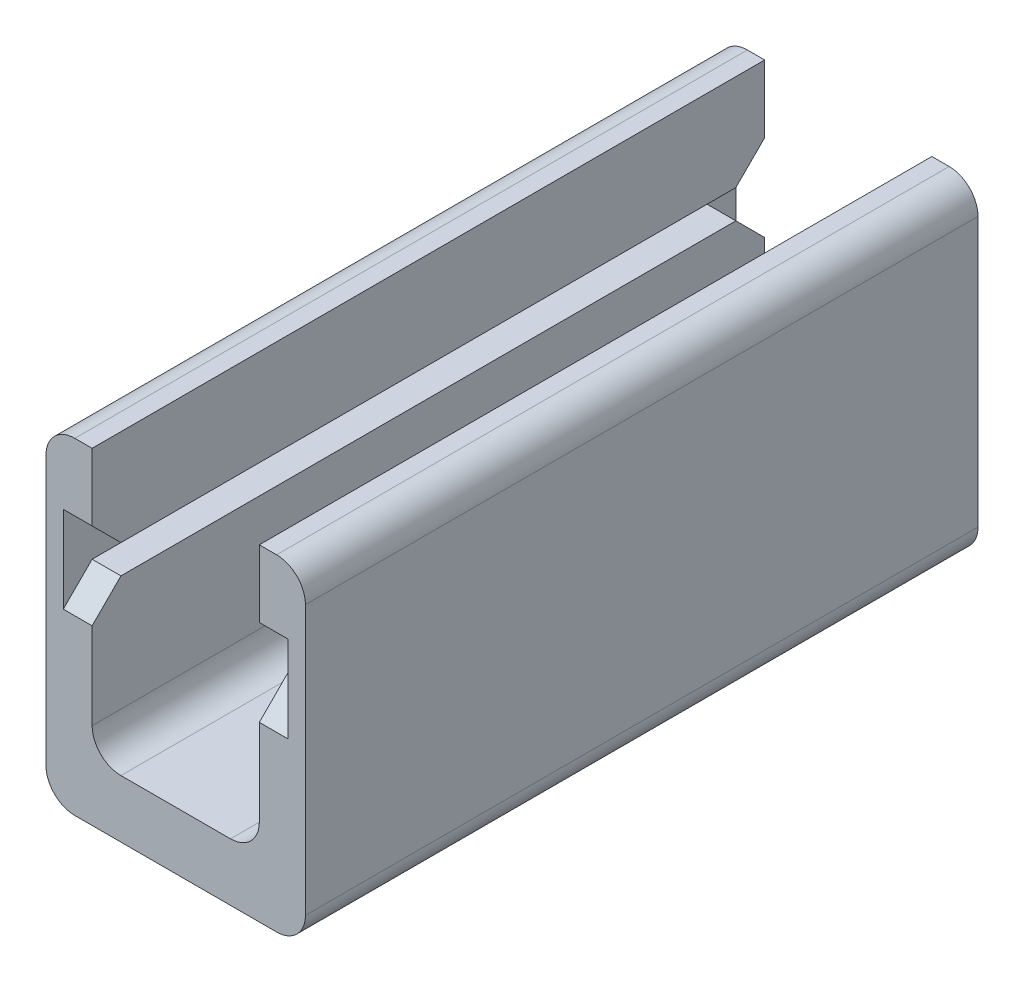
from build123d import *

# Parameters (mm, degrees)
AUFSATZ_LINEAR_AUSTRAGEN1_DEPTH = 35
VERRUNDUNG1_R                   = 1.5
FASE1_SIZE                      = 1.5


with BuildPart() as part:
    # Skizze1 → Aufsatz-Linear austragen1 (new body)
    with BuildSketch(Plane.XY):
        Polygon((-6.75, 0), (6.75, 0), (6.75, 17), (4.35, 17), (4.35, 12), (5.85, 12), (5.85, 10.5), (4.35, 10.5), (4.35, 3), (-4.35, 3), (-4.35, 10.5), (-5.85, 10.5), (-5.85, 12), (-4.35, 12), (-4.35, 17), (-6.75, 17), align=None)
    extrude(amount=AUFSATZ_LINEAR_AUSTRAGEN1_DEPTH)

    # Verrundung1
    verrundung1_edges = [part.edges().sort_by_distance(p)[0] for p in [
        (6.75, 0, 17.5),
        (-6.75, 0, 17.5),
        (-6.75, 17, 17.5),
        (-4.35, 3, 17.5),
        (4.35, 3, 17.5),
        (6.75, 17, 17.5),
    ]]
    fillet(verrundung1_edges, radius=VERRUNDUNG1_R)

    # Fase1
    fase1_edges = [part.edges().sort_by_distance(p)[0] for p in [
        (5.1, 12, 35),
        (-5.1, 12, 0),
        (-5.1, 10.5, 0),
        (5.1, 10.5, 0),
        (5.1, 12, 0),
        (5.1, 10.5, 35),
        (-5.1, 10.5, 35),
        (-5.1, 12, 35),
    ]]
    chamfer(fase1_edges, length=FASE1_SIZE)


solid = part.part
